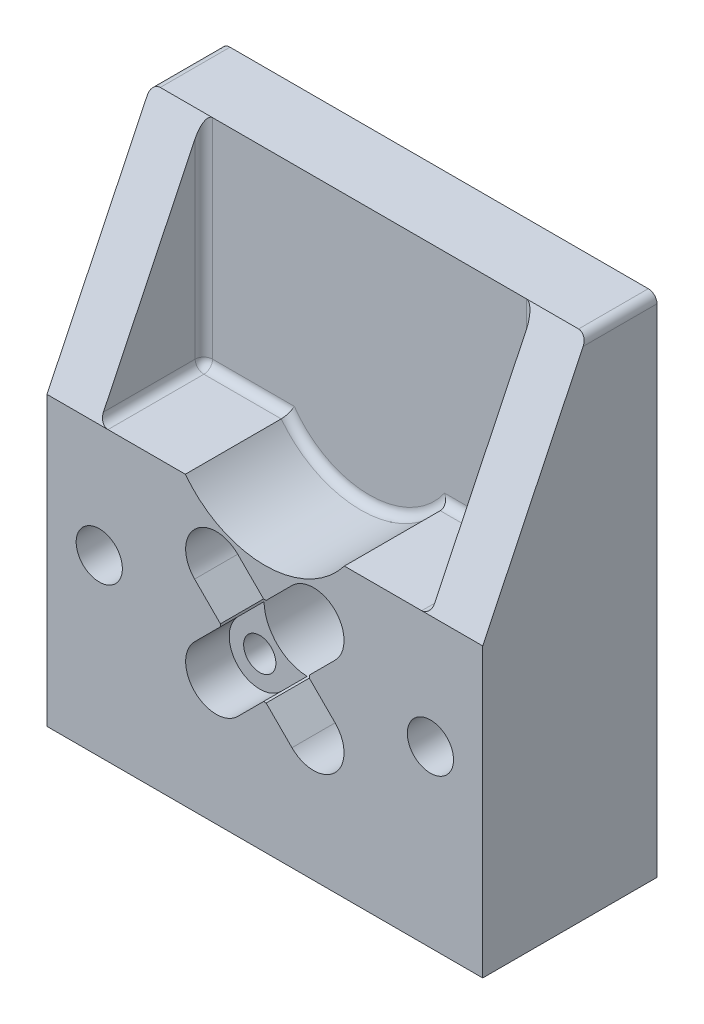
from build123d import *

# Parameters (mm, degrees)
SKETCH1_W           = 50
SKETCH1_H           = 20
BOSS_EXTRUDE1_DEPTH = 33
SKETCH2_R           = 2.65
CUT_EXTRUDE1_DEPTH  = 64.158530699
BOSS_EXTRUDE2_DEPTH = 25
CUT_EXTRUDE8_DEPTH  = 80.14543575
SKETCH10_R          = 11.5
CUT_EXTRUDE10_DEPTH = 78.5112895
FILLET1_R           = 1
SKETCH3_R           = 5.1
SKETCH3_R_2         = 1.85
CUT_EXTRUDE11_DEPTH = 80.14543575
SKETCH11_R          = 11.15
CUT_EXTRUDE12_DEPTH = 3.8
CUT_EXTRUDE14_DEPTH = 5


with BuildPart() as part:
    # Sketch1 → Boss-Extrude1 (new body)
    with BuildSketch(Plane(origin=(0, 0, 0), x_dir=(1, 0, 0), z_dir=(0, 1, 0))):
        with Locations((25, 10)):
            Rectangle(SKETCH1_W, SKETCH1_H)
    extrude(amount=BOSS_EXTRUDE1_DEPTH)

    # Sketch2 → Cut-Extrude1 (cut, through all)
    with BuildSketch(Plane.XY):
        with Locations((6, 20)):
            Circle(SKETCH2_R)
        with Locations((44, 20)):
            Circle(SKETCH2_R)
    extrude(amount=-CUT_EXTRUDE1_DEPTH, mode=Mode.SUBTRACT)

    # Sketch7 → Boss-Extrude2 (add)
    with BuildSketch(Plane(origin=(0, 33, 0), x_dir=(1, 0, 0), z_dir=(0, 1, 0))):
        Polygon((50, 0), (50, 20), (0, 20), (0, 0), (6, 0), (6, 12), (44, 12), (44, 0), align=None)
    extrude(amount=BOSS_EXTRUDE2_DEPTH)

    # Sketch8 → Cut-Extrude8 (cut, through all)
    with BuildSketch(Plane.ZY):
        Polygon((0, 58), (0, 33), (-12, 58), align=None)
    extrude(amount=-CUT_EXTRUDE8_DEPTH, mode=Mode.SUBTRACT)

    # Sketch10 → Cut-Extrude10 (cut, through all)
    with BuildSketch(Plane.XY.offset(-12)):
        with Locations((25, 40)):
            Circle(SKETCH10_R)
    extrude(amount=CUT_EXTRUDE10_DEPTH, mode=Mode.SUBTRACT)

    # Fillet1
    fillet1_edges = [part.edges().sort_by_distance(p)[0] for p in [
        (6, 33, -6),
        (10.937928102, 33, -12),
        (6, 45.5, -12),
        (44, 33, -6),
        (44, 45.5, -12),
        (0, 58, -16),
        (50, 58, -16),
        (39.062071898, 33, -12),
        (25, 28.5, -12),
    ]]
    fillet(fillet1_edges, radius=FILLET1_R)

    # Sketch3 → Cut-Extrude11 (cut, through all)
    with BuildSketch(Plane.XY):
        with Locations((25, 20)):
            Circle(SKETCH3_R)
        with Locations((19.413856429, 25.586143571)):
            Circle(SKETCH3_R_2)
        with Locations((30.586143571, 25.586143571)):
            Circle(SKETCH3_R_2)
        with Locations(Location((30.586143571, 14.413856429, 0), (0, 0, 180))):
            Circle(SKETCH3_R_2)
        with Locations(Location((19.413856429, 14.413856429, 0), (0, 0, 180))):
            Circle(SKETCH3_R_2)
    extrude(amount=-CUT_EXTRUDE11_DEPTH, mode=Mode.SUBTRACT)

    # Sketch11 → Cut-Extrude12 (cut)
    with BuildSketch(Plane(origin=(0, 0, -20), x_dir=(-1, 0, 0), z_dir=(0, 0, -1))):
        with Locations((-25, 20)):
            Circle(SKETCH11_R)
    extrude(amount=-CUT_EXTRUDE12_DEPTH, mode=Mode.SUBTRACT)

    # Sketch12 → Cut-Extrude14 (cut)
    # profile 1 of 16: a face of its own
    with BuildSketch(Plane.XY):
        with BuildLine():
            ThreePointArc((21.888730163, 28.061017306), (16.938982694, 28.061017306), (16.938982694, 23.111269837))
            Line((16.938982694, 23.111269837), (19.413856429, 25.586143571))
            Line((19.413856429, 25.586143571), (21.888730163, 28.061017306))
        make_face()
    # profile 2 of 16: a face of its own
    with BuildSketch(Plane.XY):
        with BuildLine():
            Line((21.888730163, 28.061017306), (19.413856429, 25.586143571))
            Line((19.413856429, 25.586143571), (21.393755416, 23.606244584))
            ThreePointArc((21.393755416, 23.606244584), (22.039987111, 24.153110124), (22.76777875, 24.585541221))
            ThreePointArc((22.76777875, 24.585541221), (22.877144471, 25.080539044), (22.913856429, 25.586143571))
            ThreePointArc((22.913856429, 25.586143571), (22.647434792, 26.925535585), (21.888730163, 28.061017306))
        make_face()
    # profile 3 of 16: a face of its own
    with BuildSketch(Plane.XY):
        with BuildLine():
            Line((24.851898324, 25.097849144), (21.888730163, 28.061017306))
            ThreePointArc((21.888730163, 28.061017306), (22.647434792, 26.925535585), (22.913856429, 25.586143571))
            ThreePointArc((22.913856429, 25.586143571), (22.877144471, 25.080539044), (22.76777875, 24.585541221))
            ThreePointArc((22.76777875, 24.585541221), (23.78258505, 24.952565077), (24.851898324, 25.097849144))
        make_face()
    # profile 4 of 16: a face of its own
    with BuildSketch(Plane.XY):
        with BuildLine():
            Line((19.413856429, 25.586143571), (16.938982694, 23.111269837))
            ThreePointArc((16.938982694, 23.111269837), (18.555631148, 22.192996158), (20.414458779, 22.23222125))
            ThreePointArc((20.414458779, 22.23222125), (20.846889876, 22.960012889), (21.393755416, 23.606244584))
            Line((21.393755416, 23.606244584), (19.413856429, 25.586143571))
        make_face()
    # profile 5 of 16: a face of its own
    with BuildSketch(Plane.XY):
        with BuildLine():
            Line((16.938982694, 23.111269837), (19.902150856, 20.148101676))
            ThreePointArc((19.902150856, 20.148101676), (20.047434923, 21.21741495), (20.414458779, 22.23222125))
            ThreePointArc((20.414458779, 22.23222125), (18.555631148, 22.192996158), (16.938982694, 23.111269837))
        make_face()
    # profile 6 of 16: a face of its own
    with BuildSketch(Plane.XY):
        with BuildLine():
            ThreePointArc((25.148101676, 25.097849144), (26.21741495, 24.952565077), (27.23222125, 24.585541221))
            ThreePointArc((27.23222125, 24.585541221), (27.192996158, 26.444368852), (28.111269837, 28.061017306))
            Line((28.111269837, 28.061017306), (25.148101676, 25.097849144))
        make_face()
    # profile 7 of 16: a face of its own
    with BuildSketch(Plane.XY):
        with BuildLine():
            ThreePointArc((27.23222125, 24.585541221), (27.960012889, 24.153110124), (28.606244584, 23.606244584))
            Line((28.606244584, 23.606244584), (30.586143571, 25.586143571))
            Line((30.586143571, 25.586143571), (28.111269837, 28.061017306))
            ThreePointArc((28.111269837, 28.061017306), (27.192996158, 26.444368852), (27.23222125, 24.585541221))
        make_face()
    # profile 8 of 16: a face of its own
    with BuildSketch(Plane.XY):
        with BuildLine():
            Line((28.111269837, 28.061017306), (30.586143571, 25.586143571))
            Line((30.586143571, 25.586143571), (33.061017306, 23.111269837))
            ThreePointArc((33.061017306, 23.111269837), (33.819721935, 24.246751558), (34.086143571, 25.586143571))
            ThreePointArc((34.086143571, 25.586143571), (31.925535585, 28.819721935), (28.111269837, 28.061017306))
        make_face()
    # profile 9 of 16: a face of its own
    with BuildSketch(Plane.XY):
        with BuildLine():
            Line((30.586143571, 25.586143571), (28.606244584, 23.606244584))
            ThreePointArc((28.606244584, 23.606244584), (29.153110124, 22.960012889), (29.585541221, 22.23222125))
            ThreePointArc((29.585541221, 22.23222125), (31.444368852, 22.192996158), (33.061017306, 23.111269837))
            Line((33.061017306, 23.111269837), (30.586143571, 25.586143571))
        make_face()
    # profile 10 of 16: a face of its own
    with BuildSketch(Plane.XY):
        with BuildLine():
            ThreePointArc((33.061017306, 23.111269837), (31.444368852, 22.192996158), (29.585541221, 22.23222125))
            ThreePointArc((29.585541221, 22.23222125), (29.952565077, 21.21741495), (30.097849144, 20.148101676))
            Line((30.097849144, 20.148101676), (33.061017306, 23.111269837))
        make_face()
    # profile 11 of 16: a face of its own
    with BuildSketch(Plane.XY):
        with BuildLine():
            ThreePointArc((27.23222125, 15.414458779), (27.192996158, 13.555631148), (28.111269837, 11.938982694))
            ThreePointArc((28.111269837, 11.938982694), (31.925535585, 11.180278065), (34.086143571, 14.413856429))
            ThreePointArc((34.086143571, 14.413856429), (33.819721928, 15.753248458), (33.061017281, 16.888730188))
            ThreePointArc((33.061017281, 16.888730188), (31.444368835, 17.807003846), (29.585541221, 17.76777875))
            ThreePointArc((29.585541221, 17.76777875), (29.153110124, 17.039987111), (28.606244584, 16.393755416))
            ThreePointArc((28.606244584, 16.393755416), (27.960012889, 15.846889876), (27.23222125, 15.414458779))
        make_face()
        with BuildLine():
            ThreePointArc((32.436143571, 14.413856429), (29.878179221, 12.704679293), (29.277996026, 15.722003974))
            ThreePointArc((29.277996026, 15.722003974), (31.294107921, 16.123033564), (32.436143571, 14.413856429))
        make_face(mode=Mode.SUBTRACT)
    # profile 12 of 16: a face of its own
    with BuildSketch(Plane.XY):
        with BuildLine():
            ThreePointArc((27.23222125, 15.414458779), (26.21741495, 15.047434923), (25.148101676, 14.902150856))
            Line((25.148101676, 14.902150856), (28.111269837, 11.938982694))
            ThreePointArc((28.111269837, 11.938982694), (27.192996158, 13.555631148), (27.23222125, 15.414458779))
        make_face()
    # profile 13 of 16: a face of its own
    with BuildSketch(Plane.XY):
        with BuildLine():
            ThreePointArc((22.76777875, 15.414458779), (22.039987111, 15.846889876), (21.393755416, 16.393755416))
            ThreePointArc((21.393755416, 16.393755416), (20.846889876, 17.039987111), (20.414458779, 17.76777875))
            ThreePointArc((20.414458779, 17.76777875), (18.555631148, 17.807003842), (16.938982694, 16.888730163))
            ThreePointArc((16.938982694, 16.888730163), (16.9389827, 11.938982689), (21.888730174, 11.938982705))
            ThreePointArc((21.888730174, 11.938982705), (22.647434795, 13.074464422), (22.913856429, 14.413856429))
            ThreePointArc((22.913856429, 14.413856429), (22.877144471, 14.919460956), (22.76777875, 15.414458779))
        make_face()
        with BuildLine():
            ThreePointArc((21.263856429, 14.413856429), (17.704679293, 13.705892079), (20.722003974, 15.722003974))
            ThreePointArc((20.722003974, 15.722003974), (21.123033564, 15.121820779), (21.263856429, 14.413856429))
        make_face(mode=Mode.SUBTRACT)
    # profile 14 of 16: a face of its own
    with BuildSketch(Plane.XY):
        with BuildLine():
            ThreePointArc((24.851898324, 14.902150856), (23.78258505, 15.047434923), (22.76777875, 15.414458779))
            ThreePointArc((22.76777875, 15.414458779), (22.877144471, 14.919460956), (22.913856429, 14.413856429))
            ThreePointArc((22.913856429, 14.413856429), (22.647434795, 13.074464422), (21.888730174, 11.938982705))
            Line((21.888730174, 11.938982705), (24.851898324, 14.902150856))
        make_face()
    # profile 15 of 16: a face of its own
    with BuildSketch(Plane.XY):
        with BuildLine():
            ThreePointArc((16.938982694, 16.888730163), (18.555631148, 17.807003842), (20.414458779, 17.76777875))
            ThreePointArc((20.414458779, 17.76777875), (20.047434923, 18.78258505), (19.902150856, 19.851898324))
            Line((19.902150856, 19.851898324), (16.938982694, 16.888730163))
        make_face()
    # profile 16 of 16: a face of its own
    with BuildSketch(Plane.XY):
        with BuildLine():
            Line((33.061017281, 16.888730188), (30.097849144, 19.851898324))
            ThreePointArc((30.097849144, 19.851898324), (29.952565077, 18.78258505), (29.585541221, 17.76777875))
            ThreePointArc((29.585541221, 17.76777875), (31.444368835, 17.807003846), (33.061017281, 16.888730188))
        make_face()
    extrude(amount=-CUT_EXTRUDE14_DEPTH, mode=Mode.SUBTRACT)


solid = part.part
